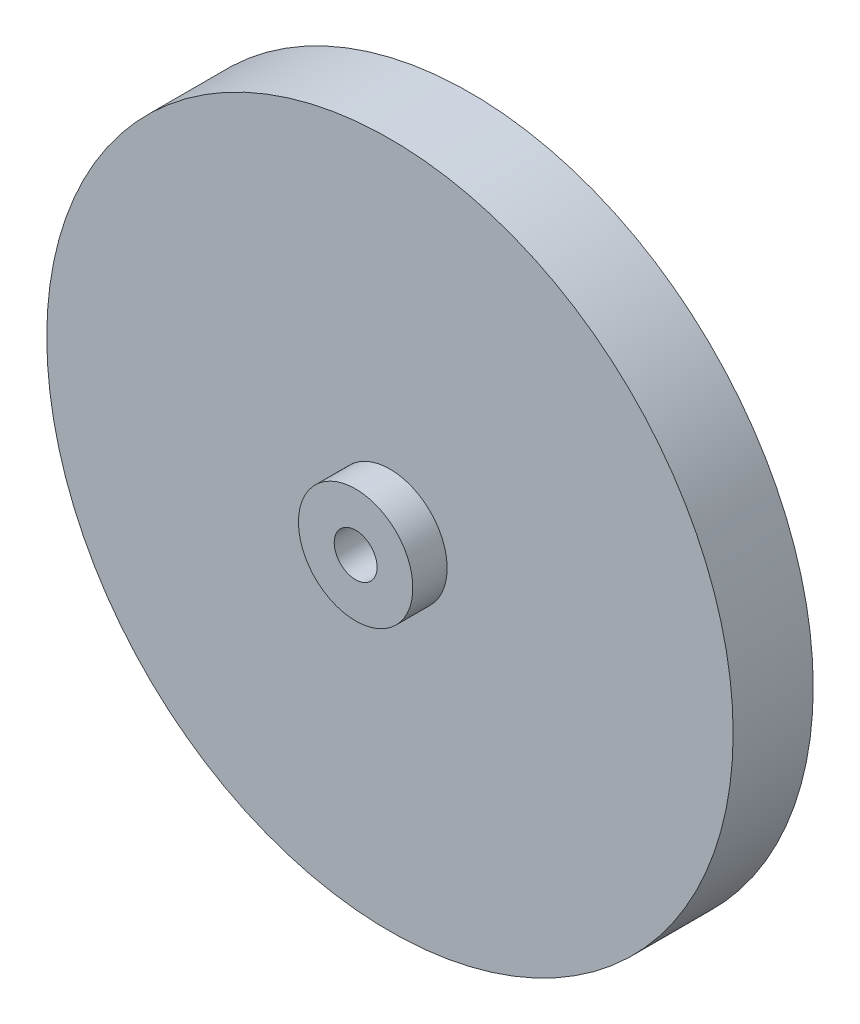
from build123d import *


with BuildPart() as part:
    # Sketch1 → Revolve1 (revolve)
    with BuildSketch(Plane(origin=(0, 0, 0), x_dir=(1, 0, 0), z_dir=(0, 1, 0))):
        Polygon((-3.75, 40.494827586), (-10, 40.494827586), (-60, 40.494827586), (-60, 26.494827586), (-10, 26.494827586), (-10, 20.494827586), (-3.75, 20.494827586), align=None)
    revolve(axis=Axis((0, 0, -56.201149425), (0, 0, 1)))


solid = part.part
